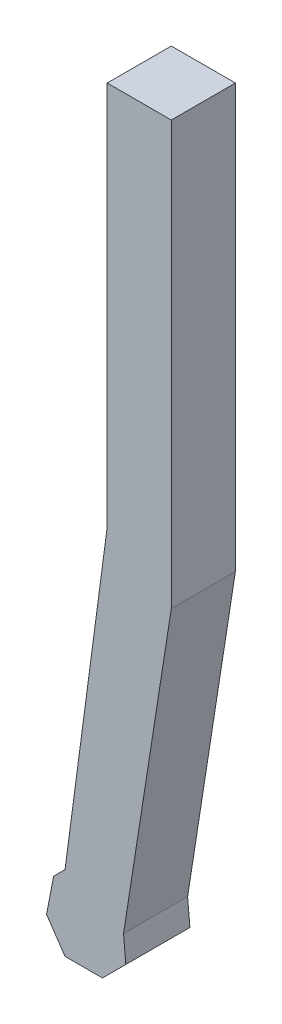
from build123d import *

# Parameters (mm, degrees)
BOSS_EXTRUDE2_DEPTH = 5


with BuildPart() as part:
    # Sketch9 → Boss-Extrude2 (new body)
    with BuildSketch(Plane.XY):
        Polygon((1.084500007, 39.42624482), (6.084500007, 39.42624482), (6.084500007, 6.42624482), (2.357800388, -17.401497524), (2.535580579, -19.39619644), (0.712067708, -21.219709311), (-2.20483497, -21.219709311), (-3.642286514, -19.102591809), (-3.096472876, -16.248053868), (-2.20483497, -15.356415962), (1.084500007, 9.42624482), align=None)
    extrude(amount=BOSS_EXTRUDE2_DEPTH)


solid = part.part
